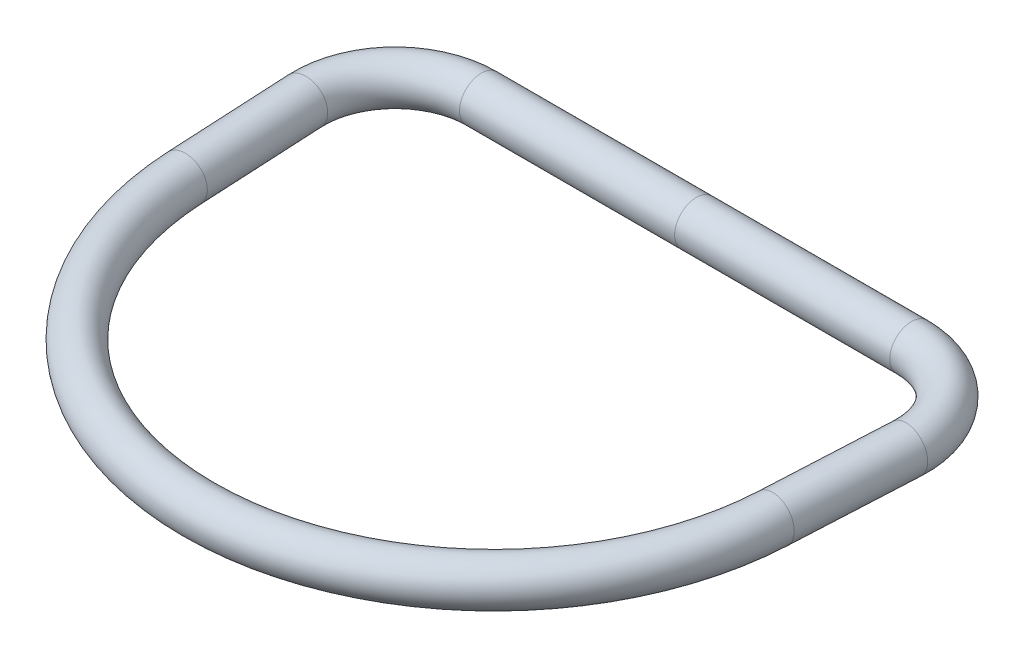
from build123d import *

# Parameters (mm, degrees)
SKETCH2_R = 3.4925


with BuildPart() as part:
    # Sweep1: sweep along a path in Sketch1
    with BuildLine(Plane(origin=(0, -2.640079968, 0), x_dir=(-1, 0, 0), z_dir=(0, -1, 0))) as sweep1_path:
        Line((47.148871667, -14.404549513), (48.185003302, 5.91211987))
        ThreePointArc((48.185003302, 5.91211987), (44.412571052, 16.104658175), (34.42540277, 20.391329599))
        Line((34.42540277, 20.391329599), (-34.42540277, 20.391329599))
        ThreePointArc((-34.42540277, 20.391329599), (-44.412571052, 16.104658175), (-48.185003302, 5.91211987))
        Line((-48.185003302, 5.91211987), (-47.148871667, -14.404549513))
        ThreePointArc((-47.148871667, -14.404549513), (0, -59.210146768), (47.148871667, -14.404549513))
    # Sketch2 → Sweep1 (sweep)
    with BuildSketch(Plane(origin=(0, 0, 0), x_dir=(0, 0, -1), z_dir=(1, 0, 0))):
        with Locations((20.391329599, -2.640079968)):
            Circle(SKETCH2_R)
    sweep(path=sweep1_path.line)


solid = part.part
